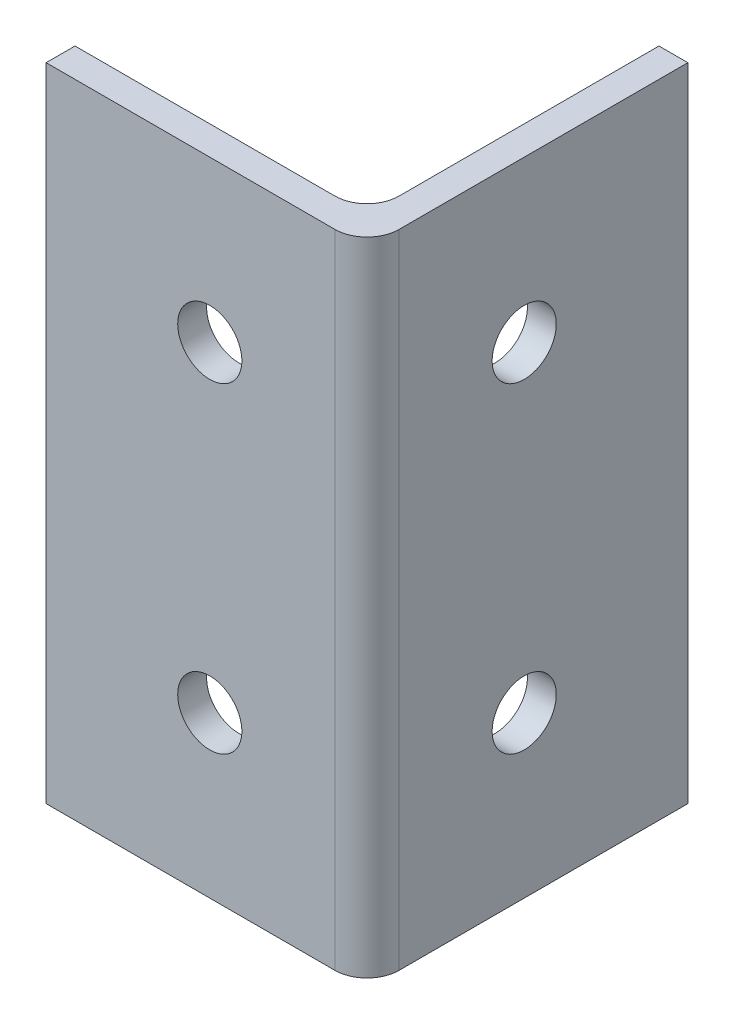
from build123d import *

# Parameters (mm, degrees)
BOSS_EXTRUDE1_DEPTH = 50.8
FILLET1_R           = 2.54
FILLET2_R           = 2.54
SKETCH7_R           = 2.54
CUT_EXTRUDE1_DEPTH  = 50.8
SKETCH3_R           = 2.54
CUT_EXTRUDE2_DEPTH  = 50.8


with BuildPart() as part:
    # Sketch2 → Boss-Extrude1 (new body)
    with BuildSketch(Plane(origin=(0, 0, 0), x_dir=(1, 0, 0), z_dir=(0, 1, 0))):
        Polygon((-22.709183551, 14.294994846), (-22.709183551, -8.819005154), (-45.823183551, -8.819005154), (-45.823183551, -11.105005154), (-20.423183551, -11.105005154), (-20.423183551, 14.294994846), align=None)
    extrude(amount=BOSS_EXTRUDE1_DEPTH)

    # Fillet1
    fillet1_edges = [part.edges().sort_by_distance(p)[0] for p in [
        (-22.709183551, 25.4, 8.819005154),
    ]]
    fillet(fillet1_edges, radius=FILLET1_R)

    # Fillet2
    fillet2_edges = [part.edges().sort_by_distance(p)[0] for p in [
        (-20.423183551, 25.4, 11.105005154),
    ]]
    fillet(fillet2_edges, radius=FILLET2_R)

    # Sketch7 → Cut-Extrude1 (cut)
    with BuildSketch(Plane(origin=(0, 0, 8.819005154), x_dir=(-1, 0, 0), z_dir=(0, 0, -1))):
        with Locations((32.869183551, 38.1)):
            Circle(SKETCH7_R)
        with Locations((32.869183551, 12.7)):
            Circle(SKETCH7_R)
    extrude(amount=-CUT_EXTRUDE1_DEPTH, mode=Mode.SUBTRACT)

    # Sketch3 → Cut-Extrude2 (cut)
    with BuildSketch(Plane.ZY.offset(22.709183551)):
        with Locations((-1.340994846, 12.7)):
            Circle(SKETCH3_R)
        with Locations((-1.340994846, 38.1)):
            Circle(SKETCH3_R)
    extrude(amount=-CUT_EXTRUDE2_DEPTH, mode=Mode.SUBTRACT)


solid = part.part
